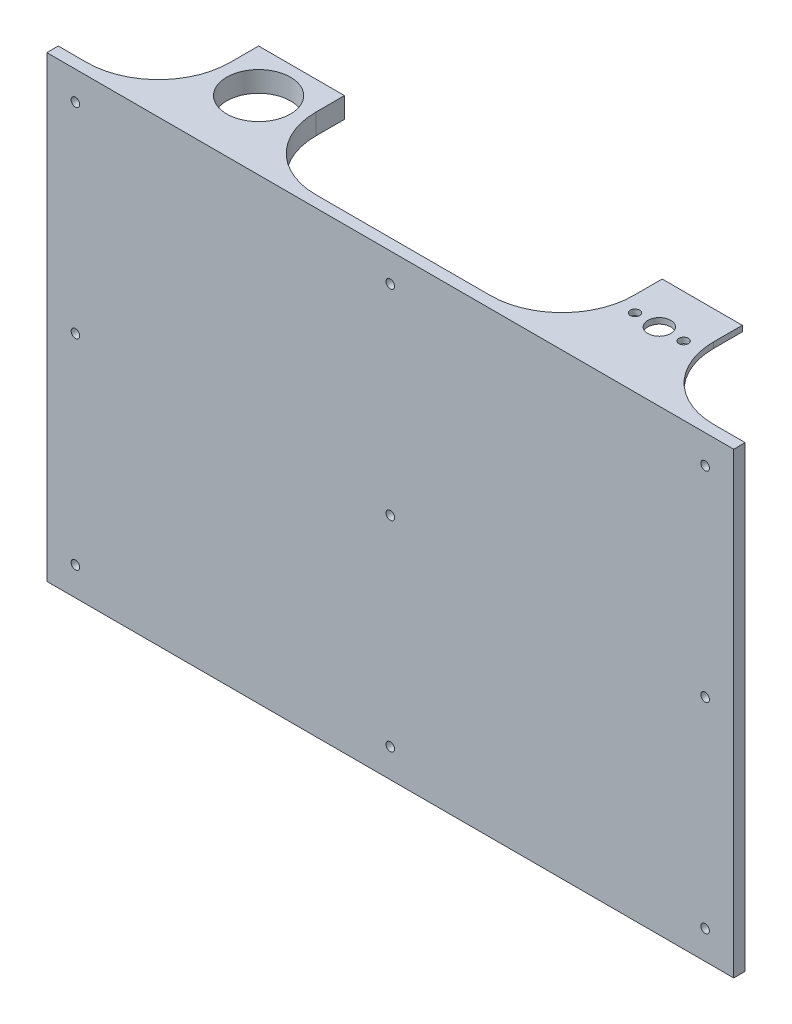
from build123d import *

# Parameters (mm, degrees)
SKETCH1_W           = 240
SKETCH1_H           = 160
BOSS_EXTRUDE1_DEPTH = 4
SKETCH2_W           = 28
SKETCH2_H           = 2
SKETCH2_W_2         = 30
SKETCH2_H_2         = 7.2
BOSS_EXTRUDE3_DEPTH = 35
SKETCH3_R           = 1.65
SKETCH3_R_2         = 4
SKETCH3_R_3         = 11.15
CUT_EXTRUDE1_DEPTH  = 170
SKETCH5_R           = 1.5
CUT_EXTRUDE2_DEPTH  = 4
FILLET1_R           = 25


with BuildPart() as part:
    # Sketch1 → Boss-Extrude1 (new body)
    with BuildSketch(Plane.XY):
        Rectangle(SKETCH1_W, SKETCH1_H)
    extrude(amount=BOSS_EXTRUDE1_DEPTH)

    # Sketch2 → Boss-Extrude3 (add)
    with BuildSketch(Plane(origin=(0, 0, 0), x_dir=(-1, 0, 0), z_dir=(0, 0, -1))):
        with Locations((-70, 79)):
            Rectangle(SKETCH2_W, SKETCH2_H)
        with Locations((-70, -79)):
            Rectangle(SKETCH2_W, SKETCH2_H)
        with Locations((70, -76.4)):
            Rectangle(SKETCH2_W_2, SKETCH2_H_2)
        with Locations((70, 76.4)):
            Rectangle(SKETCH2_W_2, SKETCH2_H_2)
    extrude(amount=BOSS_EXTRUDE3_DEPTH)

    # Sketch3 → Cut-Extrude1 (cut)
    with BuildSketch(Plane.XZ.offset(80)):
        with Locations((78.5, -20)):
            Circle(SKETCH3_R)
        with Locations((61.5, -20)):
            Circle(SKETCH3_R)
        with Locations((70, -20)):
            Circle(SKETCH3_R_2)
        with Locations((-70, -20)):
            Circle(SKETCH3_R_3)
    extrude(amount=-CUT_EXTRUDE1_DEPTH, mode=Mode.SUBTRACT)

    # Sketch5 → Cut-Extrude2 (cut)
    with BuildSketch(Plane.XY.offset(4)):
        with Locations((-110, 70)):
            Circle(SKETCH5_R)
        with Locations((0, 70)):
            Circle(SKETCH5_R)
        with Locations((110, 70)):
            Circle(SKETCH5_R)
        Circle(SKETCH5_R)
        with Locations((110, 0)):
            Circle(SKETCH5_R)
        with Locations((0, -70)):
            Circle(SKETCH5_R)
        with Locations((110, -70)):
            Circle(SKETCH5_R)
        with Locations((-110, 0)):
            Circle(SKETCH5_R)
        with Locations((-110, -70)):
            Circle(SKETCH5_R)
    extrude(amount=-CUT_EXTRUDE2_DEPTH, mode=Mode.SUBTRACT)

    # Fillet1
    fillet1_edges = [part.edges().sort_by_distance(p)[0] for p in [
        (-85, 76.4, 0),
        (56, 79, 0),
        (-55, 76.4, 0),
        (84, 79, 0),
        (-55, -76.4, 0),
        (-85, -76.4, 0),
        (56, -79, 0),
        (84, -79, 0),
    ]]
    fillet(fillet1_edges, radius=FILLET1_R)


solid = part.part
